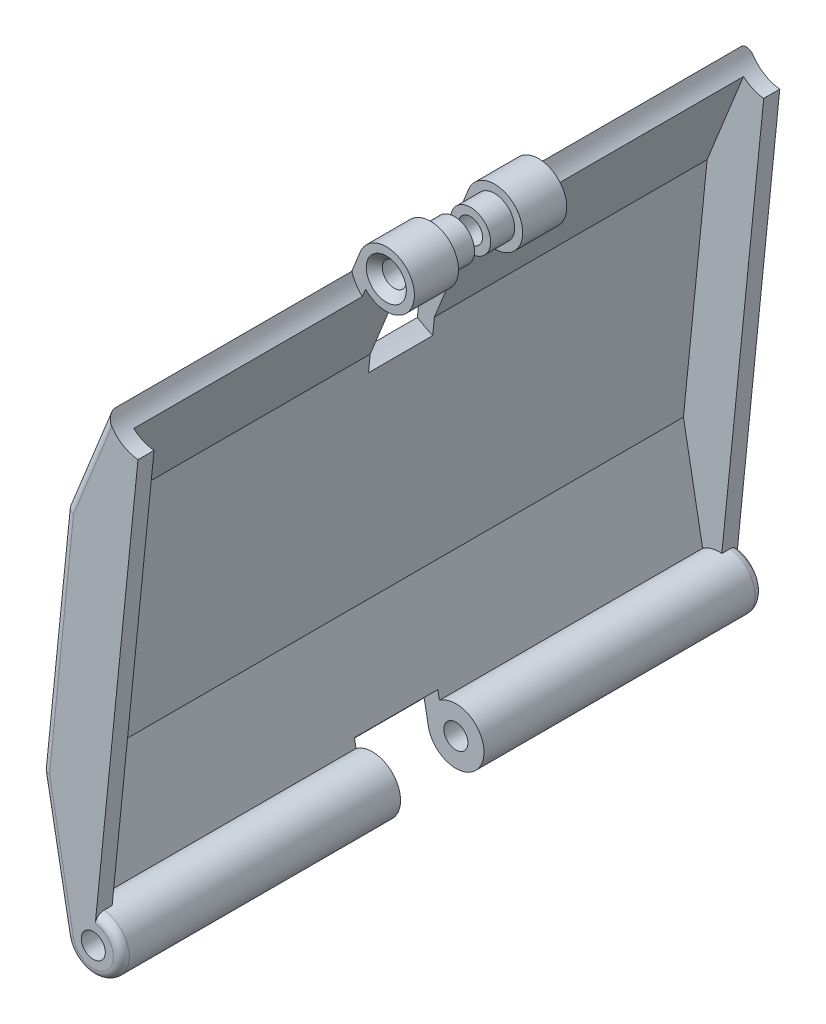
from build123d import *
from build123d.topology import SkipClean

# Parameters (mm, degrees)
CROQUIS2_R              = 1.5
SALIENTE_EXTRUIR1_DEPTH = 40
CORTAR_EXTRUIR8_DEPTH   = 38
CROQUIS21_R             = 4.5
CORTAR_EXTRUIR9_DEPTH   = 30.5
CHAFL_N1_SIZE           = 1
CROQUIS22_R             = 18.418021377
CORTAR_EXTRUIR10_DEPTH  = 4
SALIENTE_EXTRUIR2_START = 3
CROQUIS23_R             = 2.5
CROQUIS23_R_2           = 1.5
SALIENTE_EXTRUIR2_DEPTH = 3
CROQUIS24_R             = 4.5
CORTAR_EXTRUIR11_DEPTH  = 5.2
REDONDEO_CABLE_PLANO_R  = 1


with BuildPart() as part:
    # Croquis2 → Saliente-Extruir1 (new body)
    with BuildSketch(Plane.XY):
        with BuildLine():
            Line((-81.260569926, 30.810305605), (-87.479685276, 15.380704046))
            Line((-87.479685276, 15.380704046), (-90.491189661, -14.467760593))
            Line((-90.491189661, -14.467760593), (-87.479519283, -30.828684819))
            ThreePointArc((-87.479519283, -30.828684819), (-81.463725094, -32.56707429), (-83.686009105, -26.712739874))
            Line((-83.686009105, -26.712739874), (-78.365684691, 26.019547656))
            ThreePointArc((-78.365684691, 26.019547656), (-75.018767914, 31.311988091), (-81.260569926, 30.810305605))
        make_face()
        with Locations((-78.014342512, 29.50186853)):
            Circle(CROQUIS2_R, mode=Mode.SUBTRACT)
        with Locations((-84.037351283, -30.195060749)):
            Circle(CROQUIS2_R, mode=Mode.SUBTRACT)
    extrude(amount=SALIENTE_EXTRUIR1_DEPTH)

    # Croquis20 → Cortar-Extruir8 (cut)
    with BuildSketch(Plane(origin=(0, 0, 0), x_dir=(-1, 0, 0), z_dir=(0, 0, -1))):
        with BuildLine():
            Line((80.58776607, 27.129635154), (85.518345507, 14.896886302))
            Line((85.518345507, 14.896886302), (88.472734145, -14.385476766))
            Line((88.472734145, -14.385476766), (86.085050495, -27.356587931))
            ThreePointArc((86.085050495, -27.356587931), (84.944567837, -26.814682349), (83.686009105, -26.712739874))
            Line((83.686009105, -26.712739874), (78.365684691, 26.019547656))
            ThreePointArc((78.365684691, 26.019547656), (79.578515526, 26.370836307), (80.58776607, 27.129635154))
        make_face()
    extrude(amount=-CORTAR_EXTRUIR8_DEPTH, mode=Mode.SUBTRACT)

    # Croquis21 → Cortar-Extruir9 (cut)
    with BuildSketch(Plane.XY.offset(40)):
        with Locations((-78.014342512, 29.50186853)):
            Circle(CROQUIS21_R)
    extrude(amount=-CORTAR_EXTRUIR9_DEPTH, mode=Mode.SUBTRACT)

    # Chaflán1
    chafl_n1_edges = [part.edges().sort_by_distance(p)[0] for p in [
        (-79.514342512, 29.50186853, 9.5),
    ]]
    chamfer(chafl_n1_edges, length=CHAFL_N1_SIZE)

    # Croquis22 → Cortar-Extruir10 (cut)
    with BuildSketch(Plane(origin=(0, 0, 0), x_dir=(-1, 0, 0), z_dir=(0, 0, -1))):
        with Locations((78.014342512, 29.50186853)):
            Circle(CROQUIS22_R)
    extrude(amount=-CORTAR_EXTRUIR10_DEPTH, mode=Mode.SUBTRACT)

    # Croquis23 → Saliente-Extruir2 (add)
    with SkipClean():  # the faces are left unmerged after this step: merging them gives an invalid solid
        with BuildSketch(Plane(origin=(0, 0, 4), x_dir=(-1, 0, 0), z_dir=(0, 0, -1)).offset(SALIENTE_EXTRUIR2_START)):
            with Locations((78.014342512, 29.50186853)):
                Circle(CROQUIS23_R)
            with Locations((78.014342512, 29.50186853)):
                Circle(CROQUIS23_R_2, mode=Mode.SUBTRACT)
        extrude(amount=-SALIENTE_EXTRUIR2_DEPTH)

    # Croquis24 → Cortar-Extruir11 (cut)
    with SkipClean():  # the faces are left unmerged after this step: merging them gives an invalid solid
        with BuildSketch(Plane(origin=(0, 0, 0), x_dir=(-1, 0, 0), z_dir=(0, 0, -1))):
            with Locations((84.037351283, -30.195060749)):
                Circle(CROQUIS24_R)
        extrude(amount=-CORTAR_EXTRUIR11_DEPTH, mode=Mode.SUBTRACT)

    # Simetría1: part across plane


with BuildPart() as part_1:
    with SkipClean():  # the faces are left unmerged after this step: merging them gives an invalid solid
        add(part.part)
        add(part.part.mirror(Plane(origin=(-78.014342512, 29.50186853, 0), x_dir=(1, 0, 0), z_dir=(0, 0, -1))))

    # Redondeo Cable plano
    redondeo_cable_plano_edges = [part_1.edges().sort_by_distance(p)[0] for p in [
        (-81.463725094, -32.56707429, -40),
        (-84.898816017, 21.783830873, -40),
        (-88.985437468, 0.456471727, -40),
        (-88.985354472, -22.648222706, -40),
        (-88.985437468, 0.456471727, 40),
        (-88.985354472, -22.648222706, 40),
        (-81.463725094, -32.56707429, 40),
        (-84.898816017, 21.783830873, 40),
    ]]
    fillet(redondeo_cable_plano_edges, radius=REDONDEO_CABLE_PLANO_R)


solid = part_1.part
